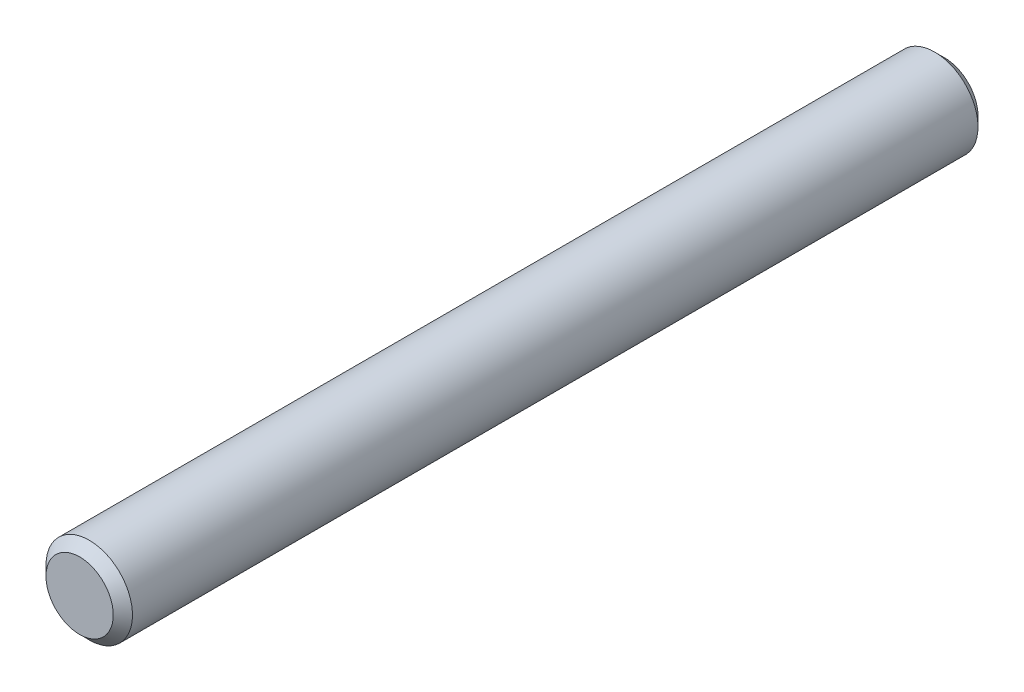
from build123d import *

# Parameters (mm, degrees)
SCHIZZO1_R                   = 2.25
ESTRUSIONE_ESTRUSIONE1_DEPTH = 45
SMUSSO1_SIZE                 = 0.5


with BuildPart() as part:
    # Schizzo1 → Estrusione-Estrusione1 (new body)
    with BuildSketch(Plane.XY):
        with Locations(Location((0, 0, 0), (0, 0, 180))):
            Circle(SCHIZZO1_R)
    extrude(amount=ESTRUSIONE_ESTRUSIONE1_DEPTH)

    # Smusso1
    smusso1_edges = [part.edges().sort_by_distance(p)[0] for p in [
        (2.25, 0, 0),
        (2.25, 0, 45),
    ]]
    chamfer(smusso1_edges, length=SMUSSO1_SIZE)


solid = part.part
